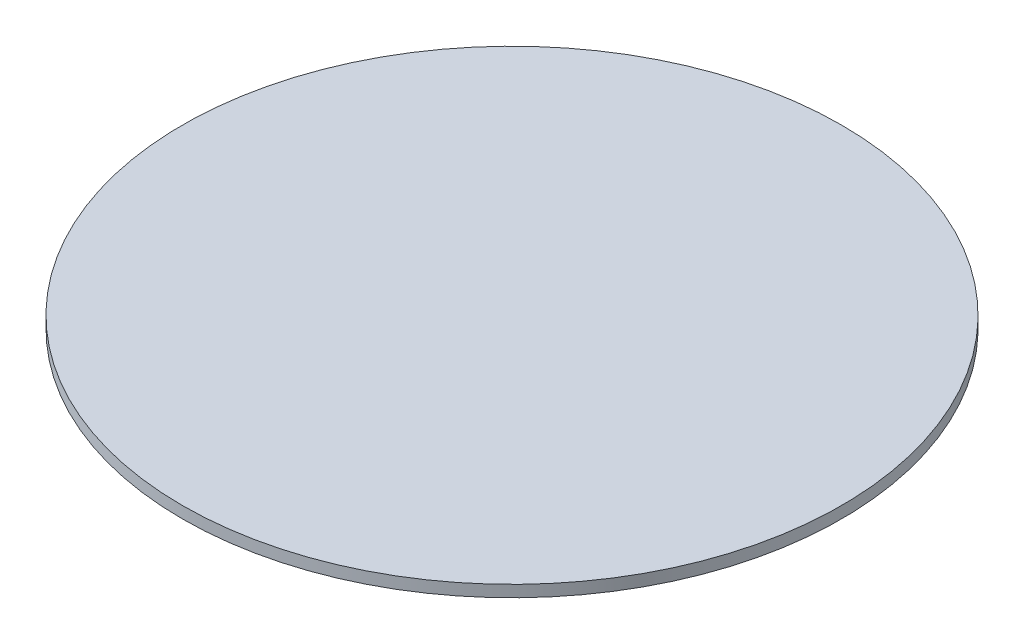
from build123d import *

# Parameters (mm, degrees)
SKETCH1_R           = 42.5
BOSS_EXTRUDE1_DEPTH = 1.5


with BuildPart() as part:
    # Sketch1 → Boss-Extrude1 (new body)
    with BuildSketch(Plane(origin=(0, 0, 0), x_dir=(1, 0, 0), z_dir=(0, 1, 0))):
        with Locations(Location((0, 0, 0), (0, 0, 270))):
            Circle(SKETCH1_R)
    extrude(amount=BOSS_EXTRUDE1_DEPTH)


solid = part.part
